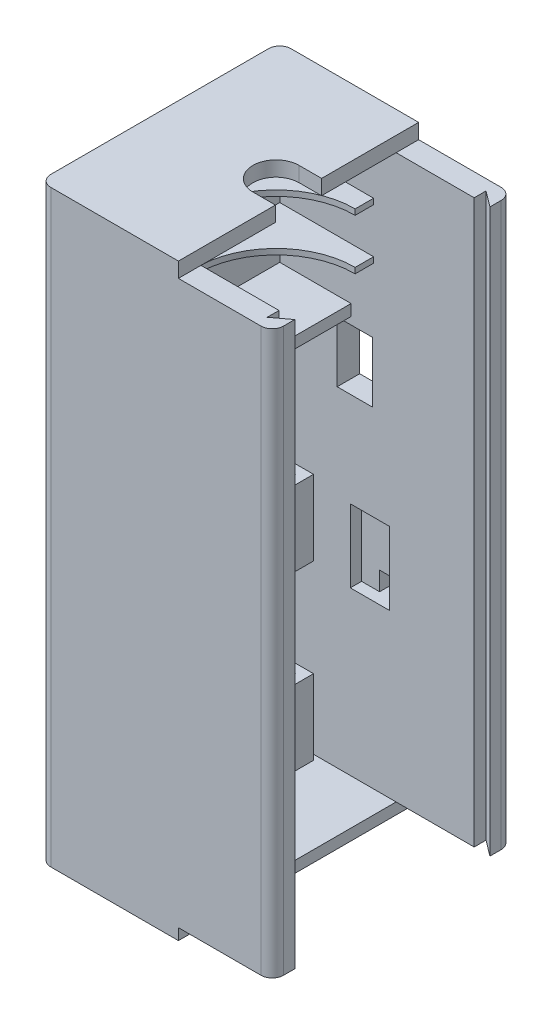
from build123d import *

# Parameters (mm, degrees)
CROQUIS1_W              = 31
CROQUIS1_H              = 32
SALIENTE_EXTRUIR1_DEPTH = 78.4
CORTAR_EXTRUIR1_START   = -2
CROQUIS2_W              = 26
CROQUIS2_H              = 20.4
CROQUIS2_H_2            = 53
CORTAR_EXTRUIR1_DEPTH   = 26
CROQUIS3_R              = 3.075
CORTAR_EXTRUIR2_DEPTH   = 5
CROQUIS4_W              = 26
CROQUIS4_H              = 75.4
CORTAR_EXTRUIR3_DEPTH   = 2
CROQUIS5_W              = 22.24757215
CROQUIS5_H              = 26
CORTAR_EXTRUIR4_DEPTH   = 19
SALIENTE_EXTRUIR4_START = 6.75
SALIENTE_EXTRUIR4_DEPTH = 0.75
MATRIZL1_COUNT          = 2
MATRIZL1_PITCH          = 6.75
SALIENTE_EXTRUIR5_START = 10
SALIENTE_EXTRUIR5_DEPTH = 10
MATRIZL2_COUNT          = 2
MATRIZL2_PITCH          = 23
CORTAR_EXTRUIR8_DEPTH   = 10
CROQUIS15_W             = 12.5
CROQUIS15_H             = 32
CORTAR_EXTRUIR11_DEPTH  = 10
CROQUIS16_W             = 14.1
CROQUIS16_H             = 53
CORTAR_EXTRUIR12_DEPTH  = 10
CORTAR_EXTRUIR13_DEPTH  = 54.5
CORTAR_EXTRUIR14_DEPTH  = 95
CORTAR_EXTRUIR15_START  = -3
CROQUIS19_W             = 4.7
CROQUIS19_H             = 8.05
CROQUIS19_W_2           = 5.2
CROQUIS19_H_2           = 9.7
CORTAR_EXTRUIR15_DEPTH  = 1.5
CROQUIS21_W             = 4.7
CROQUIS21_H             = 8.05
CROQUIS21_W_2           = 2.8
CROQUIS21_H_2           = 2.5
CORTAR_EXTRUIR16_DEPTH  = 1.5
REDONDEO1_R             = 1.5
CROQUIS22_W             = 1.718797889
CROQUIS22_H             = 0.770495605
CORTAR_EXTRUIR17_DEPTH  = 1.5


with BuildPart() as part:
    # Croquis1 → Saliente-Extruir1 (new body)
    with BuildSketch(Plane(origin=(0, 0, 0), x_dir=(1, 0, 0), z_dir=(0, 1, 0))):
        with Locations((15.5, 16)):
            Rectangle(CROQUIS1_W, CROQUIS1_H)
    extrude(amount=SALIENTE_EXTRUIR1_DEPTH)

    # Croquis2 → Cortar-Extruir1 (cut)
    with BuildSketch(Plane(origin=(31, 0, 0), x_dir=(0, 0, -1), z_dir=(1, 0, 0)).offset(CORTAR_EXTRUIR1_START)):
        with Locations((16, 66.2)):
            Rectangle(CROQUIS2_W, CROQUIS2_H)
        with Locations((16, 28)):
            Rectangle(CROQUIS2_W, CROQUIS2_H_2)
    extrude(amount=-CORTAR_EXTRUIR1_DEPTH, mode=Mode.SUBTRACT)

    # Croquis3 → Cortar-Extruir2 (cut)
    with BuildSketch(Plane(origin=(0, 78.4, 0), x_dir=(1, 0, 0), z_dir=(0, 1, 0))):
        with Locations(Location((15.5, 16, 0), (0, 0, 270))):
            Circle(CROQUIS3_R)
    extrude(amount=-CORTAR_EXTRUIR2_DEPTH, mode=Mode.SUBTRACT)

    # Croquis4 → Cortar-Extruir3 (cut)
    with BuildSketch(Plane(origin=(31, 0, 0), x_dir=(0, 0, -1), z_dir=(1, 0, 0))):
        with Locations((16, 39.2)):
            Rectangle(CROQUIS4_W, CROQUIS4_H)
    extrude(amount=-CORTAR_EXTRUIR3_DEPTH, mode=Mode.SUBTRACT)

    # Croquis5 → Cortar-Extruir4 (cut)
    with BuildSketch(Plane.XZ.offset(-54.5)):
        with Locations((23.623786075, -16)):
            Rectangle(CROQUIS5_W, CROQUIS5_H)
    extrude(amount=-CORTAR_EXTRUIR4_DEPTH, mode=Mode.SUBTRACT)

    # Croquis11 → Saliente-Extruir4 (add)
    with BuildSketch(Plane.XZ.offset(-76.4).offset(SALIENTE_EXTRUIR4_START)):
        with BuildLine():
            Line((15.5, -3), (15.5, -5.45))
            ThreePointArc((15.5, -5.45), (4.95, -16), (15.5, -26.55))
            Line((15.5, -26.55), (15.5, -29))
            Line((15.5, -29), (3, -29))
            Line((3, -29), (3, -3))
            Line((3, -3), (15.5, -3))
        make_face()
    saliente_extruir4 = extrude(amount=SALIENTE_EXTRUIR4_DEPTH)

    # MatrizL1: Saliente-Extruir4 ×2
    with Locations(*[(0, -i * MATRIZL1_PITCH, 0) for i in range(1, MATRIZL1_COUNT)]):
        add(saliente_extruir4)

    # Croquis6 → Saliente-Extruir5 (add)
    with BuildSketch(Plane.XZ.offset(-54.5).offset(SALIENTE_EXTRUIR5_START)):
        Polygon((3, -17.1), (3, -18.3), (18.2, -18.3), (18.2, -3), (17, -3), (17, -17.1), align=None)
    saliente_extruir5 = extrude(amount=SALIENTE_EXTRUIR5_DEPTH)

    # MatrizL2: Saliente-Extruir5 ×2
    with Locations(*[(0, -i * MATRIZL2_PITCH, 0) for i in range(1, MATRIZL2_COUNT)]):
        add(saliente_extruir5)

    # Croquis14 → Cortar-Extruir8 (cut)
    with BuildSketch(Plane.XZ.offset(-76.4)):
        Polygon((18.5, 0), (31, 0), (31, -32), (18.5, -32), (18.5, -19.075), (15.5, -19.075), (15.5, -12.925), (18.5, -12.925), align=None)
    extrude(amount=-CORTAR_EXTRUIR8_DEPTH, mode=Mode.SUBTRACT)

    # Croquis15 → Cortar-Extruir11 (cut)
    with BuildSketch(Plane(origin=(0, 1.5, 0), x_dir=(1, 0, 0), z_dir=(0, 1, 0))):
        with Locations((24.75, 16)):
            Rectangle(CROQUIS15_W, CROQUIS15_H)
    extrude(amount=-CORTAR_EXTRUIR11_DEPTH, mode=Mode.SUBTRACT)

    # Croquis16 → Cortar-Extruir12 (cut)
    with BuildSketch(Plane.ZY):
        with Locations((-10.05, 28)):
            Rectangle(CROQUIS16_W, CROQUIS16_H)
    extrude(amount=-CORTAR_EXTRUIR12_DEPTH, mode=Mode.SUBTRACT)

    # Croquis17 → Cortar-Extruir13 (cut)
    with BuildSketch(Plane.XZ):
        Polygon((0, -17.1), (2.1, -19.2), (2.1, -0.9), (0, -3), align=None)
    extrude(amount=-CORTAR_EXTRUIR13_DEPTH, mode=Mode.SUBTRACT)

    # Croquis18 → Cortar-Extruir14 (cut)
    with BuildSketch(Plane(origin=(0, 76.4, 0), x_dir=(1, 0, 0), z_dir=(0, 1, 0))):
        Polygon((31, 29), (28.9, 30.575), (28.9, 29), align=None)
        Polygon((28.9, 3), (31, 3), (28.9, 1.425), align=None)
    extrude(amount=-CORTAR_EXTRUIR14_DEPTH, mode=Mode.SUBTRACT)

    # Croquis19 → Cortar-Extruir15 (cut)
    with BuildSketch(Plane(origin=(0, 0, -32), x_dir=(-1, 0, 0), z_dir=(0, 0, -1)).offset(CORTAR_EXTRUIR15_START)):
        with Locations((-13, 49.5)):
            Rectangle(CROQUIS19_W, CROQUIS19_H)
        with Locations((-15, 28)):
            Rectangle(CROQUIS19_W_2, CROQUIS19_H_2)
    extrude(amount=CORTAR_EXTRUIR15_DEPTH, mode=Mode.SUBTRACT)

    # Croquis21 → Cortar-Extruir16 (cut)
    with BuildSketch(Plane(origin=(0, 0, -32), x_dir=(-1, 0, 0), z_dir=(0, 0, -1))):
        with Locations((-13, 49.5)):
            Rectangle(CROQUIS21_W, CROQUIS21_H)
        with Locations((-16.2, 24.4)):
            Rectangle(CROQUIS21_W_2, CROQUIS21_H_2)
    extrude(amount=-CORTAR_EXTRUIR16_DEPTH, mode=Mode.SUBTRACT)

    # Redondeo1
    redondeo1_edges = [part.edges().sort_by_distance(p)[0] for p in [
        (31, 38.95, -32),
        (31, 38.95, 0),
        (0, 39.2, -32),
        (0, 39.2, 0),
    ]]
    fillet(redondeo1_edges, radius=REDONDEO1_R)

    # Croquis22 → Cortar-Extruir17 (cut)
    # profile 1 of 7: a face of its own
    with BuildSketch(Plane(origin=(0, 0, -32), x_dir=(-1, 0, 0), z_dir=(0, 0, -1))):
        Polygon((-19.630531141, 44.51172003), (-19.630531141, 47.080038715), (-19.114500765, 47.080038715), (-18.082954498, 45.39252163), (-18.082954498, 47.080038715), (-17.589047059, 47.080038715), (-17.589047059, 44.51172003), (-18.120512043, 44.51172003), (-19.136623702, 46.173512769), (-19.136623702, 44.51172003), align=None)
    # profile 2 of 7: a face of its own
    with BuildSketch(Plane(origin=(0, 0, -32), x_dir=(-1, 0, 0), z_dir=(0, 0, -1))):
        with BuildLine():
            add(Edge.make_bspline(
                [(-22.49519429, 45.780444765), (-22.495012541, 45.812182987), (-22.494655608, 45.874512759), (-22.488470798, 45.965952874), (-22.480318736, 46.053601639), (-22.467043117, 46.137114298), (-22.451426142, 46.216881719), (-22.431893451, 46.292880226), (-22.408363475, 46.364843292), (-22.389645193, 46.410790932), (-22.380463708, 46.433328661)],
                knots=[0, 0, 0, 0, 1.141009212, 2.240794809, 3.294380675, 4.305229195, 5.280013876, 6.216333343, 7.125095522, 8, 8, 8, 8], degree=3))
            add(Edge.make_bspline(
                [(-22.380463708, 46.433328661), (-22.365455464, 46.465368654), (-22.335615498, 46.529071796), (-22.280197992, 46.619089457), (-22.217385515, 46.703983406), (-22.147695188, 46.783308592), (-22.072906224, 46.85587082), (-21.992665805, 46.917973639), (-21.909824632, 46.971714394), (-21.850905751, 46.998742799), (-21.821730917, 47.012126442)],
                knots=[0, 0, 0, 0, 1.031372299, 2.050613973, 3.077158538, 4.108712802, 5.127684358, 6.111366908, 7.06480644, 8, 8, 8, 8], degree=3))
            add(Edge.make_bspline(
                [(-21.821730917, 47.012126442), (-21.801927149, 47.020249506), (-21.761898683, 47.036668289), (-21.699689736, 47.057159791), (-21.635120406, 47.07380821), (-21.568657718, 47.088689957), (-21.499656375, 47.098951411), (-21.428673937, 47.107555288), (-21.355321942, 47.112064729), (-21.305705722, 47.112662228), (-21.280490681, 47.112965877)],
                knots=[0, 0, 0, 0, 0.92659354, 1.872881803, 2.832850937, 3.813025581, 4.820167273, 5.851730198, 6.908245912, 8, 8, 8, 8], degree=3))
            add(Edge.make_bspline(
                [(-21.280490681, 47.112965877), (-21.235341198, 47.111834128), (-21.146983039, 47.109619279), (-21.01791658, 47.093621689), (-20.895780523, 47.066608285), (-20.780988299, 47.027563903), (-20.672550206, 46.978757578), (-20.571308743, 46.918218891), (-20.47711407, 46.846603053), (-20.390148121, 46.76489215), (-20.311829054, 46.673228581), (-20.243619654, 46.572468622), (-20.186401188, 46.463084443), (-20.139278479, 46.345377841), (-20.103068227, 46.218964347), (-20.076906354, 46.08420065), (-20.061364083, 45.940987487), (-20.059527485, 45.842736913), (-20.058584256, 45.792277964)],
                knots=[0, 0, 0, 0, 1.064641025, 2.083517118, 3.061799897, 4.009540929, 4.938075217, 5.861300345, 6.78508344, 7.723570974, 8.670267188, 9.622657076, 10.586935816, 11.576069104, 12.607749008, 13.683335114, 14.81022093, 16, 16, 16, 16], degree=3))
            add(Edge.make_bspline(
                [(-20.058584256, 45.792277964), (-20.059505699, 45.742156895), (-20.061299577, 45.644580537), (-20.077131954, 45.502491173), (-20.102209195, 45.368709908), (-20.13929559, 45.243542346), (-20.185011885, 45.126033376), (-20.242819143, 45.017582623), (-20.309600032, 44.916751559), (-20.387807861, 44.826075737), (-20.473310124, 44.743895894), (-20.567385315, 44.673117066), (-20.66788979, 44.612496352), (-20.775736659, 44.563548985), (-20.890222994, 44.525308708), (-21.011722416, 44.498087726), (-21.140297237, 44.482151696), (-21.228311125, 44.479928806), (-21.273287864, 44.478792867)],
                knots=[0, 0, 0, 0, 1.18845052, 2.313691126, 3.386664782, 4.412527756, 5.405809582, 6.372003093, 7.321919452, 8.268293321, 9.206237639, 10.129603466, 11.054616372, 11.9847576, 12.932764752, 13.912672021, 14.933336461, 16, 16, 16, 16], degree=3))
            add(Edge.make_bspline(
                [(-21.273287864, 44.478792867), (-21.318778356, 44.479931427), (-21.407816316, 44.482159916), (-21.537762507, 44.498047437), (-21.660468017, 44.52527738), (-21.775845469, 44.563652167), (-21.884681756, 44.611855964), (-21.985972036, 44.671857223), (-22.079772301, 44.743084306), (-22.165988985, 44.82429682), (-22.244148455, 44.914706053), (-22.310834525, 45.014888802), (-22.368644798, 45.122280262), (-22.414601446, 45.238507158), (-22.45148362, 45.362373663), (-22.476622139, 45.494592516), (-22.49248513, 45.634799815), (-22.494274731, 45.73100908), (-22.49519429, 45.780444765)],
                knots=[0, 0, 0, 0, 1.080878253, 2.11558926, 3.1052859, 4.062802436, 5.000434901, 5.928596448, 6.853693179, 7.793554778, 8.738606028, 9.68692032, 10.647726704, 11.63151566, 12.651483354, 13.714466703, 14.825613081, 16, 16, 16, 16], degree=3))
        make_face()
        with BuildLine():
            add(Edge.make_bspline(
                [(-22.001286851, 45.797422833), (-22.000793443, 45.7618962), (-21.999837969, 45.693099552), (-21.989660907, 45.593242882), (-21.974216395, 45.4998909), (-21.951502973, 45.413149558), (-21.922808886, 45.332956106), (-21.887652682, 45.259243462), (-21.846179647, 45.191901838), (-21.797317078, 45.132352912), (-21.74445161, 45.0791872), (-21.687388054, 45.03318545), (-21.627189873, 44.993591463), (-21.562815456, 44.962332145), (-21.495604551, 44.937524456), (-21.425034974, 44.919130462), (-21.350755839, 44.909030354), (-21.300069818, 44.907581916), (-21.274316838, 44.906845981)],
                knots=[0, 0, 0, 0, 1.313550922, 2.543666373, 3.708465049, 4.810029406, 5.85539231, 6.85404609, 7.825601258, 8.772642133, 9.696587791, 10.59409323, 11.479048685, 12.35559886, 13.234601248, 14.125357077, 15.047515647, 16, 16, 16, 16], degree=3))
            add(Edge.make_bspline(
                [(-21.274316838, 44.906845981), (-21.248560389, 44.907567005), (-21.19786754, 44.908986095), (-21.123679671, 44.919292714), (-21.052970245, 44.936898302), (-20.986026348, 44.961578866), (-20.922542861, 44.993334544), (-20.862575077, 45.032040917), (-20.806468665, 45.078251954), (-20.753660741, 45.130645302), (-20.70611709, 45.190589746), (-20.664997164, 45.257919748), (-20.629858281, 45.332079462), (-20.601161173, 45.41309663), (-20.579006733, 45.501123685), (-20.564192549, 45.596207203), (-20.55393319, 45.69807531), (-20.552981613, 45.768412593), (-20.552491695, 45.80462565)],
                knots=[0, 0, 0, 0, 0.949153107, 1.868086493, 2.754172764, 3.630100905, 4.492260106, 5.365378617, 6.254840125, 7.166615376, 8.102436631, 9.067266169, 10.06813181, 11.121736829, 12.23011542, 13.408501285, 14.665770308, 16, 16, 16, 16], degree=3))
            add(Edge.make_bspline(
                [(-20.552491695, 45.80462565), (-20.553045064, 45.84048905), (-20.554116715, 45.909941934), (-20.563449691, 46.010524052), (-20.578735382, 46.104100286), (-20.599984181, 46.190646394), (-20.628065803, 46.270176322), (-20.661606015, 46.342907553), (-20.702160895, 46.408460105), (-20.748672373, 46.466800037), (-20.800139465, 46.518150426), (-20.855687763, 46.563105491), (-20.915632872, 46.600510838), (-20.979389738, 46.631982363), (-21.047622137, 46.655330973), (-21.119636667, 46.672361252), (-21.195637124, 46.682848524), (-21.247701235, 46.684214477), (-21.274316838, 46.684912763)],
                knots=[0, 0, 0, 0, 1.332337092, 2.580197383, 3.749299508, 4.852775005, 5.886662144, 6.878700295, 7.822989687, 8.743523536, 9.644687758, 10.519443927, 11.392806431, 12.264866173, 13.155606721, 14.065961015, 15.011303331, 16, 16, 16, 16], degree=3))
            add(Edge.make_bspline(
                [(-21.274316838, 46.684912763), (-21.300935805, 46.684225218), (-21.353006497, 46.682880276), (-21.429125422, 46.672219372), (-21.501366821, 46.655696552), (-21.569589575, 46.631014734), (-21.633901784, 46.599845436), (-21.694065574, 46.561189293), (-21.750555016, 46.51631052), (-21.802483239, 46.464181542), (-21.849748349, 46.405330734), (-21.890322759, 46.338977196), (-21.924921358, 46.265845591), (-21.953307502, 46.185719443), (-21.974350413, 46.09837833), (-21.990523642, 46.004409237), (-21.999605927, 45.903243408), (-22.0007145, 45.833454481), (-22.001286851, 45.797422833)],
                knots=[0, 0, 0, 0, 0.981996942, 1.920933313, 2.83127778, 3.712125466, 4.592427284, 5.463259035, 6.34592384, 7.249932058, 8.173122297, 9.125107726, 10.113123258, 11.154048744, 12.256187849, 13.424658091, 14.670364834, 16, 16, 16, 16], degree=3))
        make_face(mode=Mode.SUBTRACT)
    # profile 3 of 7: a face of its own
    with BuildSketch(Plane(origin=(0, 0, -32), x_dir=(-1, 0, 0), z_dir=(0, 0, -1))):
        Polygon((-19.23540519, 52.178090356), (-19.23540519, 54.746409041), (-17.490265571, 54.746409041), (-17.490265571, 54.318355927), (-18.741497751, 54.318355927), (-18.741497751, 53.692739837), (-17.654901384, 53.692739837), (-17.654901384, 53.264686723), (-18.741497751, 53.264686723), (-18.741497751, 52.178090356), align=None)
    # profile 4 of 7: a face of its own
    with BuildSketch(Plane(origin=(0, 0, -32), x_dir=(-1, 0, 0), z_dir=(0, 0, -1))):
        Polygon((-21.408597923, 52.178090356), (-21.408597923, 54.746409041), (-19.663458304, 54.746409041), (-19.663458304, 54.318355927), (-20.914690484, 54.318355927), (-20.914690484, 53.692739837), (-19.828094117, 53.692739837), (-19.828094117, 53.264686723), (-20.914690484, 53.264686723), (-20.914690484, 52.178090356), align=None)
    # profile 5 of 7: a face of its own
    with BuildSketch(Plane(origin=(0, 0, -32), x_dir=(-1, 0, 0), z_dir=(0, 0, -1))):
        with BuildLine():
            add(Edge.make_bspline(
                [(-24.273261072, 53.446815091), (-24.273079322, 53.478553314), (-24.27272239, 53.540883085), (-24.26653758, 53.632323201), (-24.258385518, 53.719971965), (-24.245109899, 53.803484624), (-24.229492924, 53.883252046), (-24.209960233, 53.959250552), (-24.186430257, 54.031213618), (-24.167711975, 54.077161258), (-24.15853049, 54.099698988)],
                knots=[0, 0, 0, 0, 1.141009212, 2.240794809, 3.294380675, 4.305229195, 5.280013876, 6.216333343, 7.125095522, 8, 8, 8, 8], degree=3))
            add(Edge.make_bspline(
                [(-24.15853049, 54.099698988), (-24.143522246, 54.13173898), (-24.11368228, 54.195442123), (-24.058264774, 54.285459784), (-23.995452297, 54.370353732), (-23.925761969, 54.449678919), (-23.850973006, 54.522241147), (-23.770732587, 54.584343966), (-23.687891414, 54.63808472), (-23.628972533, 54.665113125), (-23.599797699, 54.678496768)],
                knots=[0, 0, 0, 0, 1.031372299, 2.050613973, 3.077158538, 4.108712802, 5.127684358, 6.111366908, 7.06480644, 8, 8, 8, 8], degree=3))
            add(Edge.make_bspline(
                [(-23.599797699, 54.678496768), (-23.57999393, 54.686619832), (-23.539965465, 54.703038615), (-23.477756518, 54.723530117), (-23.413187188, 54.740178537), (-23.3467245, 54.755060283), (-23.277723157, 54.765321738), (-23.206740719, 54.773925614), (-23.133388724, 54.778435056), (-23.083772504, 54.779032554), (-23.058557463, 54.779336204)],
                knots=[0, 0, 0, 0, 0.92659354, 1.872881803, 2.832850937, 3.813025581, 4.820167273, 5.851730198, 6.908245912, 8, 8, 8, 8], degree=3))
            add(Edge.make_bspline(
                [(-23.058557463, 54.779336204), (-23.01340798, 54.778204454), (-22.92504982, 54.775989606), (-22.795983362, 54.759992015), (-22.673847304, 54.732978611), (-22.559055081, 54.693934229), (-22.450616987, 54.645127905), (-22.349375525, 54.584589217), (-22.255180852, 54.51297338), (-22.168214903, 54.431262476), (-22.089895836, 54.339598908), (-22.021686436, 54.238838949), (-21.96446797, 54.12945477), (-21.91734526, 54.011748167), (-21.881135009, 53.885334673), (-21.854973135, 53.750570977), (-21.839430865, 53.607357813), (-21.837594267, 53.50910724), (-21.836651037, 53.45864829)],
                knots=[0, 0, 0, 0, 1.064641025, 2.083517118, 3.061799897, 4.009540929, 4.938075217, 5.861300345, 6.78508344, 7.723570974, 8.670267188, 9.622657076, 10.586935816, 11.576069104, 12.607749008, 13.683335114, 14.81022093, 16, 16, 16, 16], degree=3))
            add(Edge.make_bspline(
                [(-21.836651037, 53.45864829), (-21.837572481, 53.408527221), (-21.839366359, 53.310950863), (-21.855198736, 53.1688615), (-21.880275977, 53.035080234), (-21.917362372, 52.909912673), (-21.963078667, 52.792403703), (-22.020885924, 52.683952949), (-22.087666814, 52.583121886), (-22.165874643, 52.492446064), (-22.251376906, 52.410266221), (-22.345452097, 52.339487393), (-22.445956572, 52.278866678), (-22.553803441, 52.229919311), (-22.668289776, 52.191679035), (-22.789789198, 52.164458052), (-22.918364019, 52.148522023), (-23.006377907, 52.146299132), (-23.051354646, 52.145163194)],
                knots=[0, 0, 0, 0, 1.18845052, 2.313691126, 3.386664782, 4.412527756, 5.405809582, 6.372003093, 7.321919452, 8.268293321, 9.206237639, 10.129603466, 11.054616372, 11.9847576, 12.932764752, 13.912672021, 14.933336461, 16, 16, 16, 16], degree=3))
            add(Edge.make_bspline(
                [(-23.051354646, 52.145163194), (-23.096845138, 52.146301754), (-23.185883098, 52.148530242), (-23.315829289, 52.164417764), (-23.438534799, 52.191647707), (-23.55391225, 52.230022494), (-23.662748538, 52.278226291), (-23.764038818, 52.338227549), (-23.857839082, 52.409454633), (-23.944055767, 52.490667146), (-24.022215237, 52.58107638), (-24.088901307, 52.681259128), (-24.146711579, 52.788650588), (-24.192668228, 52.904877484), (-24.229550402, 53.028743989), (-24.254688921, 53.160962842), (-24.270551912, 53.301170141), (-24.272341512, 53.397379407), (-24.273261072, 53.446815091)],
                knots=[0, 0, 0, 0, 1.080878253, 2.11558926, 3.1052859, 4.062802436, 5.000434901, 5.928596448, 6.853693179, 7.793554778, 8.738606028, 9.68692032, 10.647726704, 11.63151566, 12.651483354, 13.714466703, 14.825613081, 16, 16, 16, 16], degree=3))
        make_face()
        with BuildLine():
            add(Edge.make_bspline(
                [(-23.779353632, 53.463793159), (-23.778860225, 53.428266527), (-23.777904751, 53.359469878), (-23.767727688, 53.259613209), (-23.752283177, 53.166261227), (-23.729569754, 53.079519885), (-23.700875668, 52.999326432), (-23.665719464, 52.925613788), (-23.624246429, 52.858272165), (-23.57538386, 52.798723239), (-23.522518392, 52.745557526), (-23.465454835, 52.699555776), (-23.405256655, 52.65996179), (-23.340882238, 52.628702471), (-23.273671332, 52.603894782), (-23.203101756, 52.585500789), (-23.12882262, 52.57540068), (-23.0781366, 52.573952242), (-23.05238362, 52.573216308)],
                knots=[0, 0, 0, 0, 1.313550922, 2.543666373, 3.708465049, 4.810029406, 5.85539231, 6.85404609, 7.825601258, 8.772642133, 9.696587791, 10.59409323, 11.479048685, 12.35559886, 13.234601248, 14.125357077, 15.047515647, 16, 16, 16, 16], degree=3))
            add(Edge.make_bspline(
                [(-23.05238362, 52.573216308), (-23.026627171, 52.573937331), (-22.975934322, 52.575356422), (-22.901746453, 52.585663041), (-22.831037027, 52.603268628), (-22.76409313, 52.627949192), (-22.700609642, 52.659704871), (-22.640641858, 52.698411243), (-22.584535447, 52.744622281), (-22.531727522, 52.797015629), (-22.484183872, 52.856960072), (-22.443063946, 52.924290075), (-22.407925063, 52.998449788), (-22.379227955, 53.079466956), (-22.357073514, 53.167494012), (-22.342259331, 53.262577529), (-22.331999972, 53.364445637), (-22.331048395, 53.434782919), (-22.330558477, 53.470995976)],
                knots=[0, 0, 0, 0, 0.949153107, 1.868086493, 2.754172764, 3.630100905, 4.492260106, 5.365378617, 6.254840125, 7.166615376, 8.102436631, 9.067266169, 10.06813181, 11.121736829, 12.23011542, 13.408501285, 14.665770308, 16, 16, 16, 16], degree=3))
            add(Edge.make_bspline(
                [(-22.330558477, 53.470995976), (-22.331111846, 53.506859377), (-22.332183497, 53.57631226), (-22.341516473, 53.676894378), (-22.356802164, 53.770470612), (-22.378050962, 53.85701672), (-22.406132585, 53.936546649), (-22.439672797, 54.009277879), (-22.480227677, 54.074830432), (-22.526739155, 54.133170364), (-22.578206247, 54.184520752), (-22.633754545, 54.229475818), (-22.693699654, 54.266881165), (-22.75745652, 54.29835269), (-22.825688919, 54.321701299), (-22.897703448, 54.338731578), (-22.973703906, 54.34921885), (-23.025768017, 54.350584803), (-23.05238362, 54.35128309)],
                knots=[0, 0, 0, 0, 1.332337092, 2.580197383, 3.749299508, 4.852775005, 5.886662144, 6.878700295, 7.822989687, 8.743523536, 9.644687758, 10.519443927, 11.392806431, 12.264866173, 13.155606721, 14.065961015, 15.011303331, 16, 16, 16, 16], degree=3))
            add(Edge.make_bspline(
                [(-23.05238362, 54.35128309), (-23.079002587, 54.350595544), (-23.131073279, 54.349250602), (-23.207192204, 54.338589699), (-23.279433603, 54.322066879), (-23.347656357, 54.297385061), (-23.411968566, 54.266215762), (-23.472132355, 54.22755962), (-23.528621798, 54.182680847), (-23.58055002, 54.130551869), (-23.627815131, 54.071701061), (-23.668389541, 54.005347523), (-23.70298814, 53.932215918), (-23.731374284, 53.85208977), (-23.752417195, 53.764748657), (-23.768590423, 53.670779564), (-23.777672709, 53.569613735), (-23.778781282, 53.499824807), (-23.779353632, 53.463793159)],
                knots=[0, 0, 0, 0, 0.981996942, 1.920933313, 2.83127778, 3.712125466, 4.592427284, 5.463259035, 6.34592384, 7.249932058, 8.173122297, 9.125107726, 10.113123258, 11.154048744, 12.256187849, 13.424658091, 14.670364834, 16, 16, 16, 16], degree=3))
        make_face(mode=Mode.SUBTRACT)
    # profile 6 of 7: a face of its own
    with BuildSketch(Plane(origin=(0, 0, -32), x_dir=(-1, 0, 0), z_dir=(0, 0, -1))):
        with Locations((-23.752868183, 24.238493308)):
            Rectangle(CROQUIS22_W, CROQUIS22_H)
    # profile 7 of 7: a face of its own
    with BuildSketch(Plane(origin=(0, 0, -32), x_dir=(-1, 0, 0), z_dir=(0, 0, -1))):
        Polygon((-7.254312838, 23.260556578), (-7.254312838, 24.445934432), (-6.068934983, 24.445934432), (-6.068934983, 25.216430038), (-7.254312838, 25.216430038), (-7.254312838, 26.401807892), (-8.024808444, 26.401807892), (-8.024808444, 25.216430038), (-9.210186298, 25.216430038), (-9.210186298, 24.445934432), (-8.024808444, 24.445934432), (-8.024808444, 23.260556578), align=None)
    extrude(amount=-CORTAR_EXTRUIR17_DEPTH, mode=Mode.SUBTRACT)


solid = part.part
